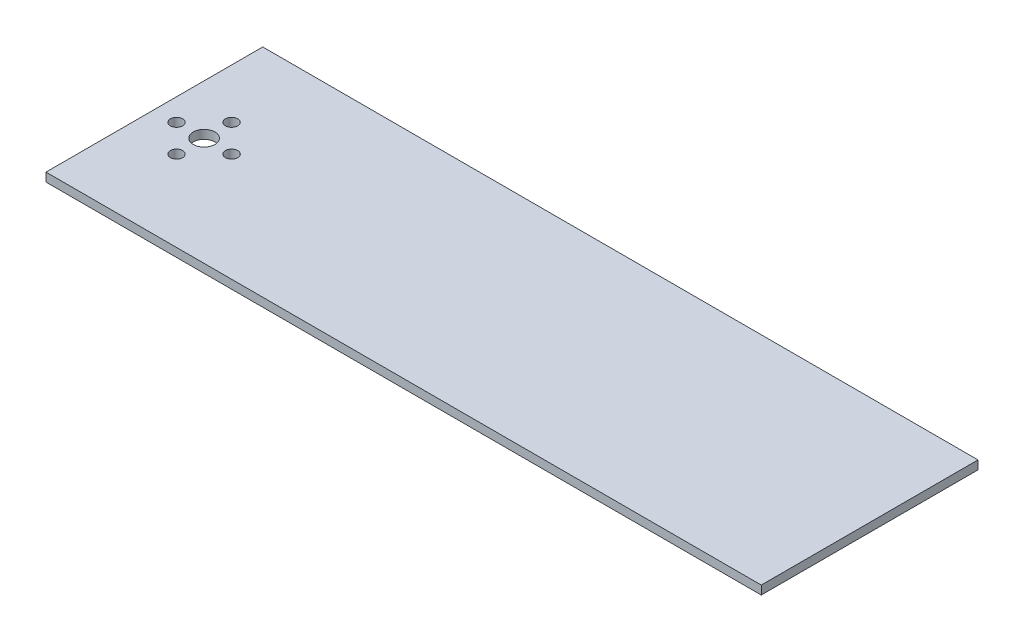
from build123d import *

# Parameters (mm, degrees)
SKETCH1_W           = 165
SKETCH1_H           = 50
BOSS_EXTRUDE1_DEPTH = 2
SKETCH2_R           = 2.5
SKETCH2_R_2         = 1.42
CUT_EXTRUDE1_DEPTH  = 2


with BuildPart() as part:
    # Sketch1 → Boss-Extrude1 (new body)
    with BuildSketch(Plane(origin=(0, 0, 0), x_dir=(1, 0, 0), z_dir=(0, 1, 0))):
        Rectangle(SKETCH1_W, SKETCH1_H)
    extrude(amount=BOSS_EXTRUDE1_DEPTH)

    # Sketch2 → Cut-Extrude1 (cut)
    with BuildSketch(Plane(origin=(0, 2, 0), x_dir=(1, 0, 0), z_dir=(0, 1, 0))):
        with Locations(Location((-71.037435181, 0, 0), (0, 0, 270))):
            Circle(SKETCH2_R)
        with Locations(Location((-71.037435181, 6.35, 0), (0, 0, 270))):
            Circle(SKETCH2_R_2)
        with Locations(Location((-77.387435181, 0, 0), (0, 0, 270))):
            Circle(SKETCH2_R_2)
        with Locations(Location((-71.037435181, -6.35, 0), (0, 0, 270))):
            Circle(SKETCH2_R_2)
        with Locations(Location((-64.687435181, 0, 0), (0, 0, 270))):
            Circle(SKETCH2_R_2)
    extrude(amount=-CUT_EXTRUDE1_DEPTH, mode=Mode.SUBTRACT)


solid = part.part
